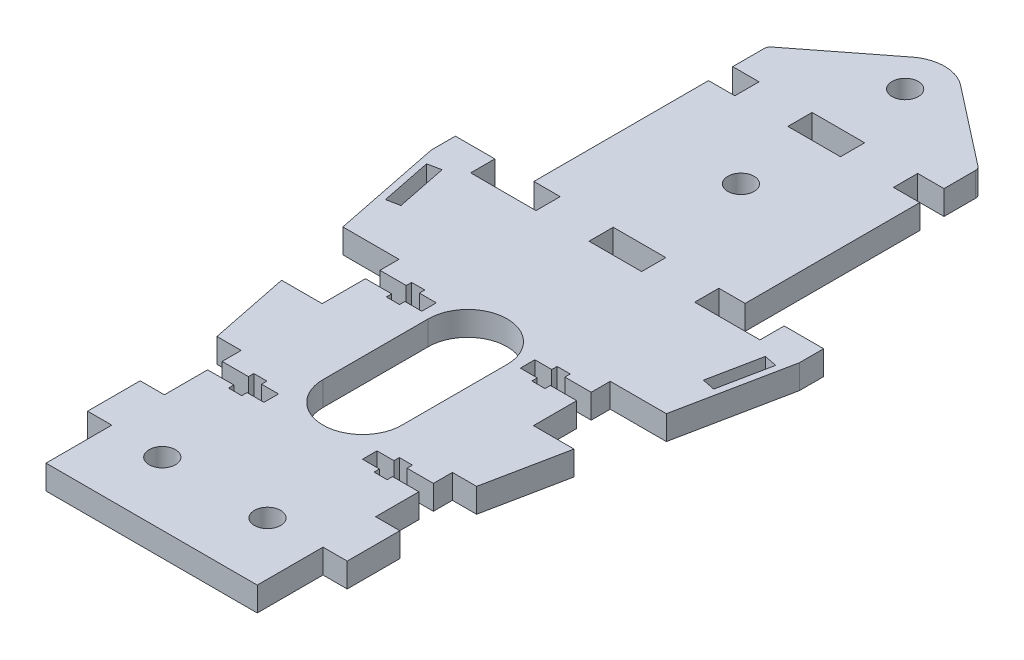
from build123d import *

# Parameters (mm, degrees)
SKETCH1_R           = 3.175
SKETCH1_W           = 12.7
SKETCH1_H           = 5.842
BOSS_EXTRUDE1_DEPTH = 5.842
CUT_EXTRUDE1_DEPTH  = 116.299365115
FILLET1_R           = 1.5875
CUT_EXTRUDE2_DEPTH  = 116.299365115


with BuildPart() as part:
    # Sketch1 → Boss-Extrude1 (new body)
    with BuildSketch(Plane(origin=(0, 0, 0), x_dir=(1, 0, 0), z_dir=(0, 1, 0))):
        with BuildLine():
            Line((31.75, 26.724230903), (25.5, 26.724230903))
            Line((25.5, 26.724230903), (19.15, 26.724230903))
            Line((19.15, 26.724230903), (19.15, 32.566230903))
            Line((19.15, 32.566230903), (25.5, 32.566230903))
            Line((25.5, 32.566230903), (25.5, 74.730230903))
            Line((25.5, 74.730230903), (19.15, 74.730230903))
            Line((19.15, 74.730230903), (19.15, 80.572230903))
            Line((19.15, 80.572230903), (25.5, 80.572230903))
            Line((25.5, 80.572230903), (25.5, 88.9))
            Line((25.5, 88.9), (5.856060063, 104.213366787))
            ThreePointArc((5.856060063, 104.213366787), (0, 106.226230903), (-5.856060063, 104.213366787))
            Line((-5.856060063, 104.213366787), (-25.5, 88.9))
            Line((-25.5, 88.9), (-25.5, 80.572230903))
            Line((-25.5, 80.572230903), (-19.15, 80.572230903))
            Line((-19.15, 80.572230903), (-19.15, 74.730230903))
            Line((-19.15, 74.730230903), (-25.5, 74.730230903))
            Line((-25.5, 74.730230903), (-25.5, 32.566230903))
            Line((-25.5, 32.566230903), (-19.15, 32.566230903))
            Line((-19.15, 32.566230903), (-19.15, 26.724230903))
            Line((-19.15, 26.724230903), (-25.5, 26.724230903))
            Line((-25.5, 26.724230903), (-31.75, 26.724230903))
            Line((-31.75, 26.724230903), (-34.925, 26.724230903))
            Line((-34.925, 26.724230903), (-34.925, 32.566230903))
            Line((-34.925, 32.566230903), (-44.45, 32.566230903))
            Line((-44.45, 32.566230903), (-44.45, 26.724230903))
            Line((-44.45, 26.724230903), (-39.046137682, 0))
            Line((-39.046137682, 0), (-31.342, 0))
            Line((-31.342, 0), (-25.5, 0))
            Line((-25.5, 0), (-25.5, -18.542))
            Line((-25.5, -18.542), (-31.342, -18.542))
            Line((-31.342, -18.542), (-35.296790677, -18.542))
            Line((-35.296790677, -18.542), (-31.342, -38.1))
            Line((-31.342, -38.1), (-25.5, -38.1))
            Line((-25.5, -38.1), (-25.5, -56.642))
            Line((-25.5, -56.642), (-31.342, -56.642))
            Line((-31.342, -56.642), (-31.342, -69.342))
            Line((-31.342, -69.342), (-25.5, -69.342))
            Line((-25.5, -69.342), (-25.5, -85.217))
            Line((-25.5, -85.217), (25.5, -85.217))
            Line((25.5, -85.217), (25.5, -69.342))
            Line((25.5, -69.342), (31.342, -69.342))
            Line((31.342, -69.342), (31.342, -56.642))
            Line((31.342, -56.642), (25.5, -56.642))
            Line((25.5, -56.642), (25.5, -38.1))
            Line((25.5, -38.1), (31.342, -38.1))
            Line((31.342, -38.1), (35.296790677, -18.542))
            Line((35.296790677, -18.542), (31.342, -18.542))
            Line((31.342, -18.542), (25.5, -18.542))
            Line((25.5, -18.542), (25.5, 0))
            Line((25.5, 0), (31.342, 0))
            Line((31.342, 0), (39.046137682, 0))
            Line((39.046137682, 0), (44.45, 26.724230903))
            Line((44.45, 26.724230903), (44.45, 32.566230903))
            Line((44.45, 32.566230903), (34.925, 32.566230903))
            Line((34.925, 32.566230903), (34.925, 26.724230903))
            Line((34.925, 26.724230903), (31.75, 26.724230903))
        make_face()
        with Locations(Location((0, 96.701230903, 0), (0, 0, 270))):
            Circle(SKETCH1_R, mode=Mode.SUBTRACT)
        with Locations(Location((0, 57.053608903, 0), (0, 0, 270))):
            Circle(SKETCH1_R, mode=Mode.SUBTRACT)
        with Locations(Location((-12.7, -69.946391097, 0), (0, 0, 270))):
            Circle(SKETCH1_R, mode=Mode.SUBTRACT)
        with Locations(Location((12.7, -69.946391097, 0), (0, 0, 90))):
            Circle(SKETCH1_R, mode=Mode.SUBTRACT)
        with Locations((0, 77.651230903)):
            Rectangle(SKETCH1_W, SKETCH1_H, mode=Mode.SUBTRACT)
        with BuildLine():
            Line((9.525, -8.911080097), (9.525, -34.311080097))
            ThreePointArc((9.525, -34.311080097), (0, -43.836080097), (-9.525, -34.311080097))
            Line((-9.525, -34.311080097), (-9.525, -8.911080097))
            ThreePointArc((-9.525, -8.911080097), (0, 0.613919903), (9.525, -8.911080097))
        make_face(mode=Mode.SUBTRACT)
        with Locations((0, 29.645230903)):
            Rectangle(SKETCH1_W, SKETCH1_H, mode=Mode.SUBTRACT)
    extrude(amount=BOSS_EXTRUDE1_DEPTH)

    # Sketch2 → Cut-Extrude1 (cut, through all)
    with BuildSketch(Plane(origin=(0, 5.842, 0), x_dir=(1, 0, 0), z_dir=(0, 1, 0))):
        Polygon((-15.975, -42.6974), (-15.975, -41.402), (-19.15, -41.402), (-19.15, -42.6974), (-25.5, -42.6974), (-25.5, -46.2026), (-19.15, -46.2026), (-19.15, -47.498), (-15.975, -47.498), (-15.975, -46.2026), (-11.891999892, -46.2026), (-11.891999892, -42.6974), align=None)
        Polygon((-19.15, -8.1026), (-19.15, -9.398), (-15.975, -9.398), (-15.975, -8.1026), (-11.891999892, -8.1026), (-11.891999892, -4.5974), (-15.975, -4.5974), (-15.975, -3.302), (-19.15, -3.302), (-19.15, -4.5974), (-25.5, -4.5974), (-25.5, -8.1026), align=None)
        Polygon((15.975, -8.1026), (15.975, -9.398), (19.15, -9.398), (19.15, -8.1026), (25.5, -8.1026), (25.5, -4.5974), (19.15, -4.5974), (19.15, -3.302), (15.975, -3.302), (15.975, -4.5974), (11.891999892, -4.5974), (11.891999892, -8.1026), align=None)
        Polygon((19.15, -42.6974), (19.15, -41.402), (15.975, -41.402), (15.975, -42.6974), (11.891999892, -42.6974), (11.891999892, -46.2026), (15.975, -46.2026), (15.975, -47.498), (19.15, -47.498), (19.15, -46.2026), (25.5, -46.2026), (25.5, -42.6974), align=None)
    extrude(amount=-CUT_EXTRUDE1_DEPTH, mode=Mode.SUBTRACT)

    # Fillet1
    fillet1_edges = [part.edges().sort_by_distance(p)[0] for p in [
        (-25.5, 2.921, -88.9),
        (25.5, 2.921, -88.9),
    ]]
    fillet(fillet1_edges, radius=FILLET1_R)

    # Sketch3 → Cut-Extrude2 (cut, through all)
    with BuildSketch(Plane(origin=(0, 5.842, 0), x_dir=(1, 0, 0), z_dir=(0, 1, 0))):
        Polygon((-42.137472374, 23.29757819), (-39.620370832, 10.849518107), (-36.508355811, 11.478793492), (-39.025457353, 23.926853575), align=None)
        Polygon((39.025457353, 23.926853575), (36.508355811, 11.478793492), (39.620370832, 10.849518107), (42.137472374, 23.29757819), align=None)
    extrude(amount=-CUT_EXTRUDE2_DEPTH, mode=Mode.SUBTRACT)


solid = part.part
